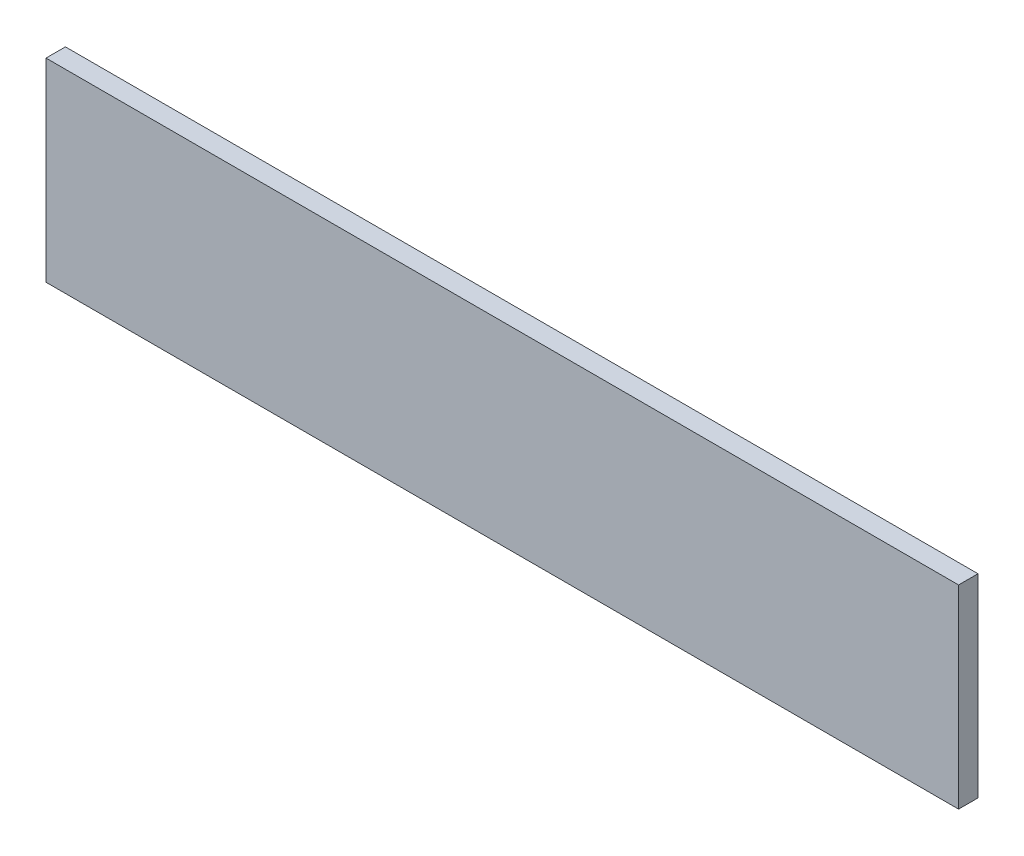
from build123d import *

# Parameters (mm, degrees)
SKETCH2_W           = 298.45
SKETCH2_H           = 63.5
BOSS_EXTRUDE1_DEPTH = 6.35


with BuildPart() as part:
    # Sketch2 → Boss-Extrude1 (new body)
    with BuildSketch(Plane.XY):
        Rectangle(SKETCH2_W, SKETCH2_H)
    extrude(amount=BOSS_EXTRUDE1_DEPTH)


solid = part.part
